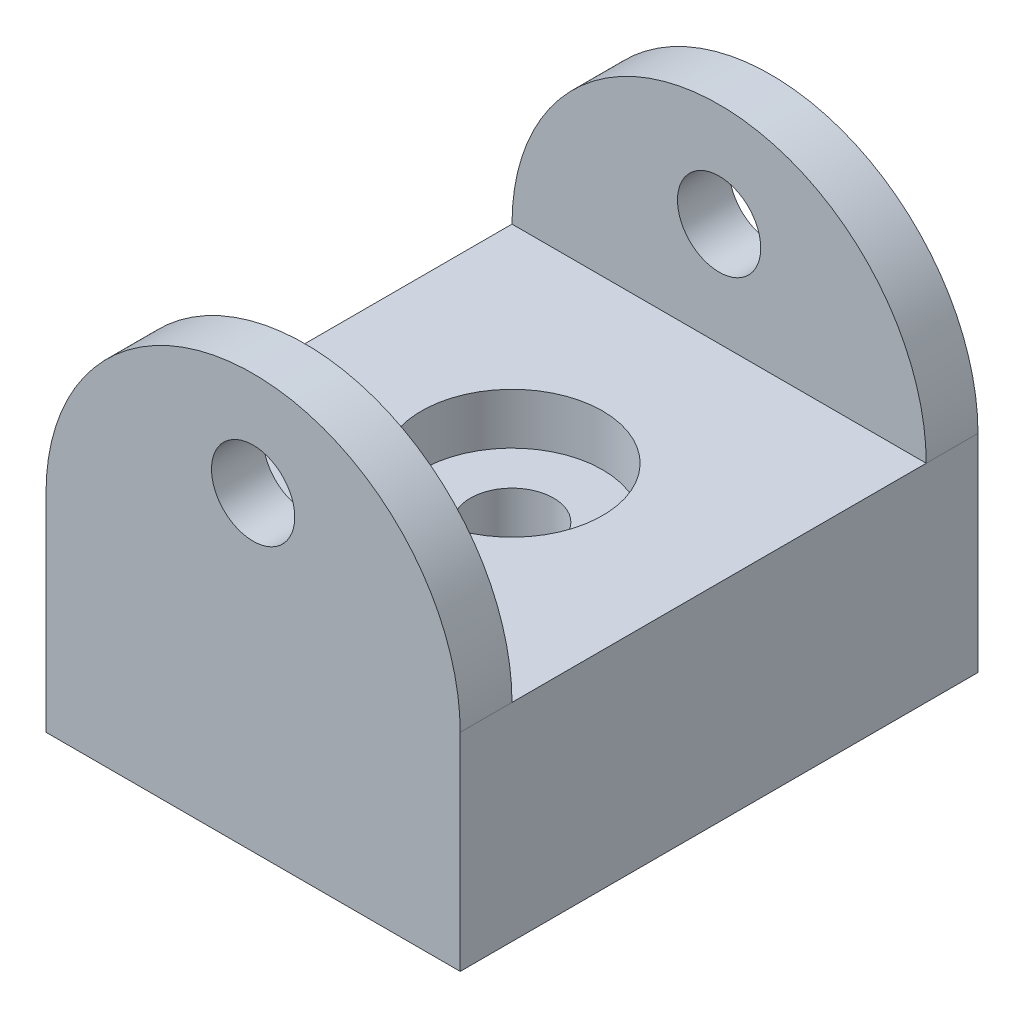
from build123d import *

# Parameters (mm, degrees)
BOSS_EXTRUDE1_DEPTH                                 = 15.875
SKETCH3_W                                           = 25.4
SKETCH3_H                                           = 12.7
CUT_EXTRUDE1_DEPTH                                  = 33.534068682
F_10_CLEARANCE_HOLE1_D                              = 5.1054
CBORE_FOR_10_BINDING_HEAD_MACHINE_SCREW_D           = 5.1054
CBORE_FOR_10_BINDING_HEAD_MACHINE_SCREW_CBORE_D     = 11.1125
CBORE_FOR_10_BINDING_HEAD_MACHINE_SCREW_CBORE_DEPTH = 3.1242


with BuildPart() as part:
    # Sketch1 → Boss-Extrude1 (new, symmetric)
    with BuildSketch(Plane.XY):
        with BuildLine():
            Line((-12.7, 0), (-12.7, -12.7))
            Line((-12.7, -12.7), (12.7, -12.7))
            Line((12.7, -12.7), (12.7, 0))
            ThreePointArc((12.7, 0), (0, 12.7), (-12.7, 0))
        make_face()
    extrude(amount=BOSS_EXTRUDE1_DEPTH, both=True)

    # Sketch3 → Cut-Extrude1 (cut, through all)
    with BuildSketch(Plane(origin=(12.7, 0, 0), x_dir=(0, 0, -1), z_dir=(1, 0, 0))):
        with Locations((0, 6.35)):
            Rectangle(SKETCH3_W, SKETCH3_H)
    extrude(amount=-CUT_EXTRUDE1_DEPTH, mode=Mode.SUBTRACT)

    # #10 Clearance Hole1 (through all)
    with Locations(Plane.XY.offset(15.875)):
        with Locations((0, 6.35)):
            Hole(F_10_CLEARANCE_HOLE1_D / 2)

    # CBORE for #10 Binding Head Machine Screw1 (through all)
    with Locations(Plane(origin=(0, 0, 0), x_dir=(1, 0, 0), z_dir=(0, 1, 0))):
        with Locations((0, 0)):
            CounterBoreHole(CBORE_FOR_10_BINDING_HEAD_MACHINE_SCREW_D / 2, CBORE_FOR_10_BINDING_HEAD_MACHINE_SCREW_CBORE_D / 2, CBORE_FOR_10_BINDING_HEAD_MACHINE_SCREW_CBORE_DEPTH)


solid = part.part
